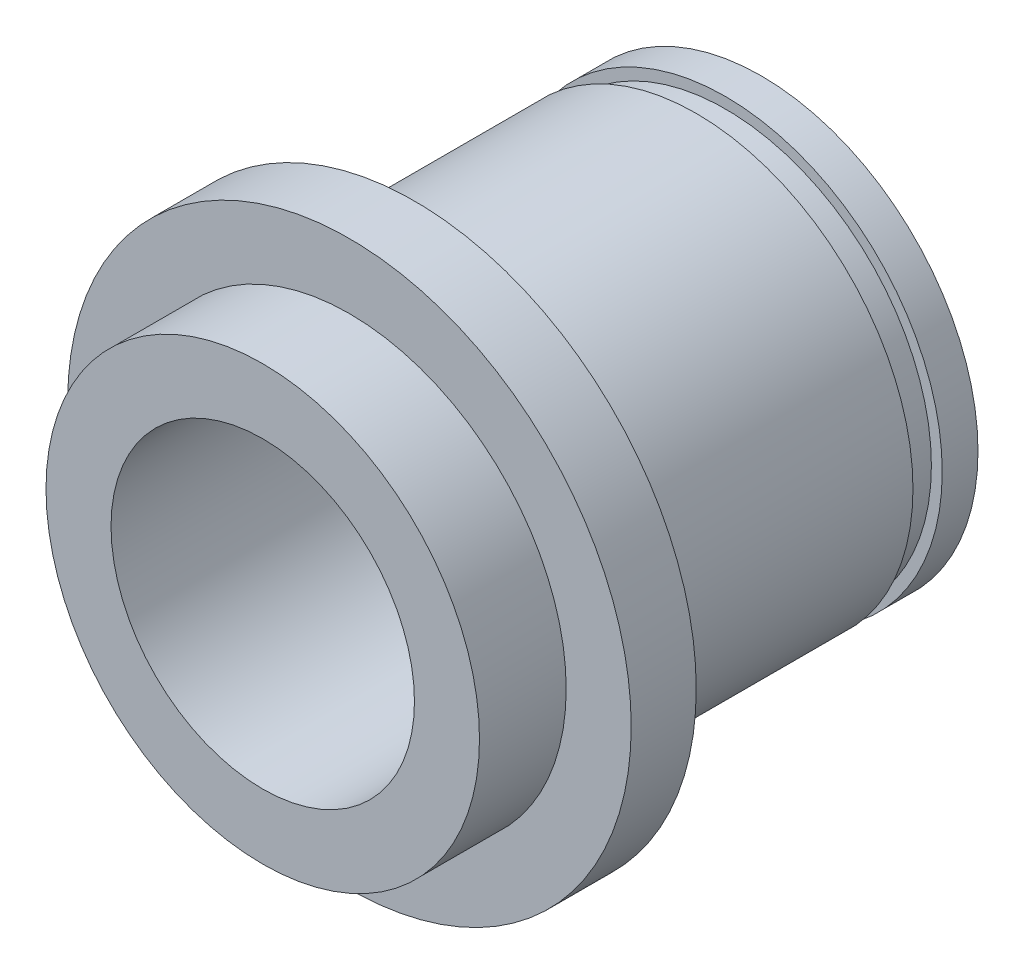
from build123d import *

# Parameters (mm, degrees)
CUT_EXTRUDE1_DEPTH      = 30.444863729
CUT_EXTRUDE1_DEPTH_BACK = 30.444863729
SKETCH3_R               = 7


with BuildPart() as part:
    # Sketch2 → Revolve1 (revolve)
    with BuildSketch(Plane.YZ, mode=Mode.PRIVATE) as revolve1_sk:
        Polygon((0, 7), (10, 7), (10, 3), (13, 3), (13, 0), (10, 0), (10, -13), (9.5, -13), (9.5, -14.35), (10, -14.35), (10, -16), (0, -16), align=None)
    revolve(revolve1_sk.sketch.rotate(Axis((0, 0, 15.904017857), (0, 0, -1)), 90), axis=Axis((0, 0, 15.904017857), (0, 0, -1)))

    # Sketch3 → Cut-Extrude1 (cut, two sides: drawn at the far end of the back side and taken through both)
    with BuildSketch(Plane.XY.offset(7).offset(-CUT_EXTRUDE1_DEPTH_BACK)):
        Circle(SKETCH3_R)
    extrude(amount=CUT_EXTRUDE1_DEPTH + CUT_EXTRUDE1_DEPTH_BACK, mode=Mode.SUBTRACT)


solid = part.part
